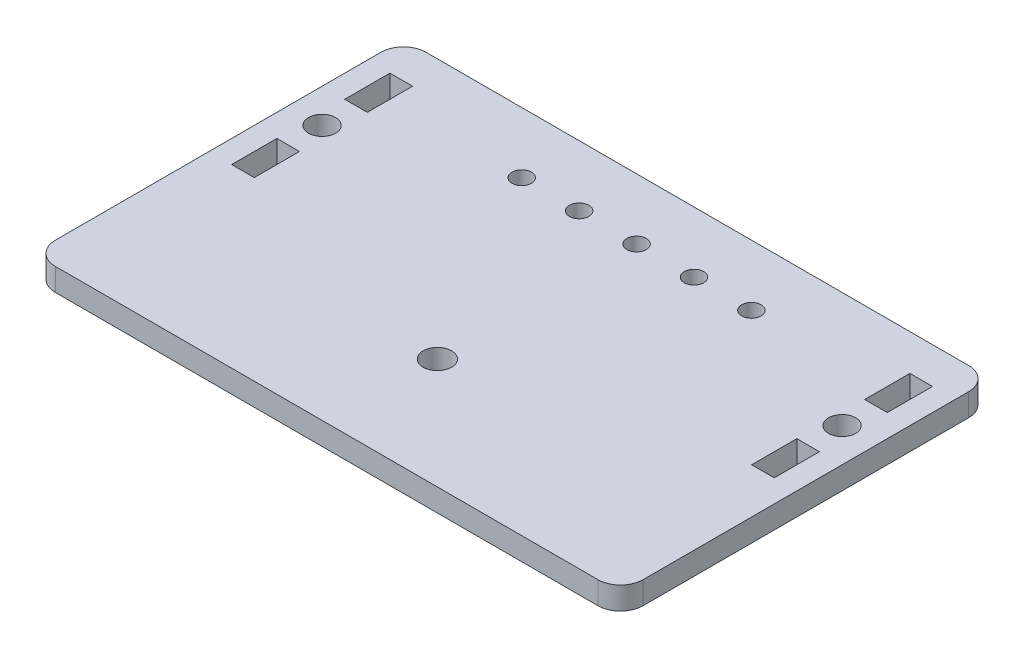
from build123d import *

# Parameters (mm, degrees)
SKETCH1_W           = 130
SKETCH1_H           = 50
BOSS_EXTRUDE1_DEPTH = 5
SKETCH2_W           = 130
SKETCH2_H           = 5
BOSS_EXTRUDE2_DEPTH = 32
SKETCH3_R           = 3
SKETCH3_W           = 5
SKETCH3_H           = 10
CUT_EXTRUDE1_DEPTH  = 10
FILLET1_R           = 5
CUT_EXTRUDE2_REACH  = 88.597
SKETCH4_R           = 3.15
SKETCH4_R_2         = 2.15


with BuildPart() as part:
    # Sketch1 → Boss-Extrude1 (new body)
    with BuildSketch(Plane(origin=(0, 0, 0), x_dir=(1, 0, 0), z_dir=(0, 1, 0))):
        Rectangle(SKETCH1_W, SKETCH1_H)
    extrude(amount=BOSS_EXTRUDE1_DEPTH)

    # Sketch2 → Boss-Extrude2 (add)
    with BuildSketch(Plane(origin=(0, 0, -25), x_dir=(-1, 0, 0), z_dir=(0, 0, -1))):
        with Locations((0, 2.5)):
            Rectangle(SKETCH2_W, SKETCH2_H)
    extrude(amount=BOSS_EXTRUDE2_DEPTH)

    # Sketch3 → Cut-Extrude1 (cut)
    with BuildSketch(Plane(origin=(0, 5, 0), x_dir=(1, 0, 0), z_dir=(0, 1, 0))):
        with Locations(Location((-57.5, 31.5, 0), (0, 0, 270))):
            Circle(SKETCH3_R)
        with Locations(Location((57.5, 31.5, 0), (0, 0, 270))):
            Circle(SKETCH3_R)
        with Locations((57.5, 44)):
            Rectangle(SKETCH3_W, SKETCH3_H)
        with Locations((-57.5, 19)):
            Rectangle(SKETCH3_W, SKETCH3_H)
        with Locations((-57.5, 44)):
            Rectangle(SKETCH3_W, SKETCH3_H)
        with Locations((57.5, 19)):
            Rectangle(SKETCH3_W, SKETCH3_H)
    extrude(amount=-CUT_EXTRUDE1_DEPTH, mode=Mode.SUBTRACT)

    # Fillet1
    fillet1_edges = [part.edges().sort_by_distance(p)[0] for p in [
        (65, 2.5, -57),
        (-65, 2.5, -57),
        (65, 2.5, 25),
        (-65, 2.5, 25),
    ]]
    fillet(fillet1_edges, radius=FILLET1_R)

    # Sketch4 → Cut-Extrude2 (cut, up to next)
    with BuildSketch(Plane(origin=(0, 5, 0), x_dir=(1, 0, 0), z_dir=(0, 1, 0)), mode=Mode.PRIVATE) as cut_extrude2_sk1:
        with Locations(Location((0, -0.5, 0), (0, 0, 270))):
            Circle(SKETCH4_R)
    cut_extrude2_tool1 = extrude(cut_extrude2_sk1.sketch, amount=-CUT_EXTRUDE2_REACH, mode=Mode.PRIVATE) & part.part
    # Sketch4 → Cut-Extrude2 (cut, up to next)
    with BuildSketch(Plane(origin=(0, 5, 0), x_dir=(1, 0, 0), z_dir=(0, 1, 0)), mode=Mode.PRIVATE) as cut_extrude2_sk2:
        with Locations(Location((25.4, 43.55, 0), (0, 0, 270))):
            Circle(SKETCH4_R_2)
    cut_extrude2_tool2 = extrude(cut_extrude2_sk2.sketch, amount=-CUT_EXTRUDE2_REACH, mode=Mode.PRIVATE) & part.part
    # Sketch4 → Cut-Extrude2 (cut, up to next)
    with BuildSketch(Plane(origin=(0, 5, 0), x_dir=(1, 0, 0), z_dir=(0, 1, 0)), mode=Mode.PRIVATE) as cut_extrude2_sk3:
        with Locations(Location((-25.4, 43.55, 0), (0, 0, 270))):
            Circle(SKETCH4_R_2)
    cut_extrude2_tool3 = extrude(cut_extrude2_sk3.sketch, amount=-CUT_EXTRUDE2_REACH, mode=Mode.PRIVATE) & part.part
    # Sketch4 → Cut-Extrude2 (cut, up to next)
    with BuildSketch(Plane(origin=(0, 5, 0), x_dir=(1, 0, 0), z_dir=(0, 1, 0)), mode=Mode.PRIVATE) as cut_extrude2_sk4:
        with Locations(Location((-12.7, 43.55, 0), (0, 0, 270))):
            Circle(SKETCH4_R_2)
    cut_extrude2_tool4 = extrude(cut_extrude2_sk4.sketch, amount=-CUT_EXTRUDE2_REACH, mode=Mode.PRIVATE) & part.part
    # Sketch4 → Cut-Extrude2 (cut, up to next)
    with BuildSketch(Plane(origin=(0, 5, 0), x_dir=(1, 0, 0), z_dir=(0, 1, 0)), mode=Mode.PRIVATE) as cut_extrude2_sk5:
        with Locations(Location((12.7, 43.55, 0), (0, 0, 270))):
            Circle(SKETCH4_R_2)
    cut_extrude2_tool5 = extrude(cut_extrude2_sk5.sketch, amount=-CUT_EXTRUDE2_REACH, mode=Mode.PRIVATE) & part.part
    # Sketch4 → Cut-Extrude2 (cut, up to next)
    with BuildSketch(Plane(origin=(0, 5, 0), x_dir=(1, 0, 0), z_dir=(0, 1, 0)), mode=Mode.PRIVATE) as cut_extrude2_sk6:
        with Locations(Location((0, 43.55, 0), (0, 0, 270))):
            Circle(SKETCH4_R_2)
    cut_extrude2_tool6 = extrude(cut_extrude2_sk6.sketch, amount=-CUT_EXTRUDE2_REACH, mode=Mode.PRIVATE) & part.part
    add(cut_extrude2_tool1.solids().sort_by_distance((0, 5, 0.5))[0], mode=Mode.SUBTRACT)
    add(cut_extrude2_tool2.solids().sort_by_distance((25.4, 5, -43.55))[0], mode=Mode.SUBTRACT)
    add(cut_extrude2_tool3.solids().sort_by_distance((-25.4, 5, -43.55))[0], mode=Mode.SUBTRACT)
    add(cut_extrude2_tool4.solids().sort_by_distance((-12.7, 5, -43.55))[0], mode=Mode.SUBTRACT)
    add(cut_extrude2_tool5.solids().sort_by_distance((12.7, 5, -43.55))[0], mode=Mode.SUBTRACT)
    add(cut_extrude2_tool6.solids().sort_by_distance((0, 5, -43.55))[0], mode=Mode.SUBTRACT)


solid = part.part
